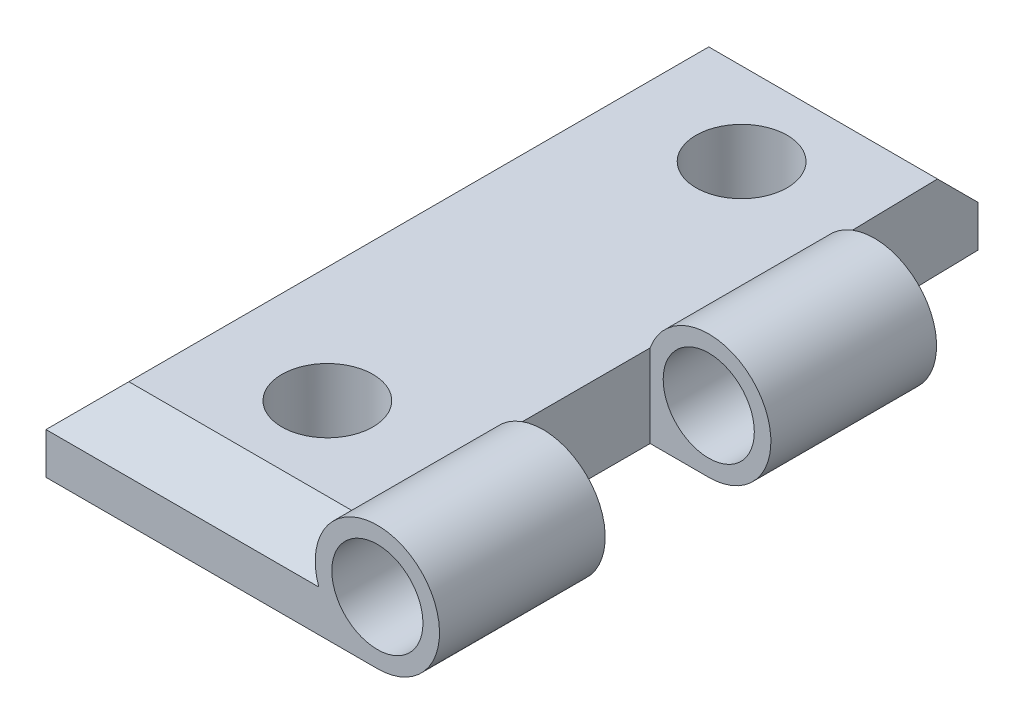
from build123d import *

# Parameters (mm, degrees)
IZIM1_R                     = 2.75
Y_KSEKLIK_EKSTR_ZYON1_DEPTH = 40
PAH3_SIZE                   = 2.5
IZIM2_R                     = 2.75
IZIM2_W                     = 7.285533906
IZIM2_H                     = 10
KES_EKSTR_ZYON1_DEPTH       = 40
KES_EKSTR_ZYON2_DEPTH       = 88


with BuildPart() as part:
    # Çizim1 → Yükseklik-Ekstrüzyon1 (new body)
    with BuildSketch(Plane.XY):
        with BuildLine():
            Line((-64.233873571, 5), (-64.233873571, 0))
            Line((-64.233873571, 0), (-44.233873571, 0))
            ThreePointArc((-44.233873571, 0), (-41.172011393, 5.915063509), (-47.769407477, 5))
            Line((-47.769407477, 5), (-64.233873571, 5))
        make_face()
        with Locations((-44.233873571, 3.75)):
            Circle(IZIM1_R, mode=Mode.SUBTRACT)
    extrude(amount=Y_KSEKLIK_EKSTR_ZYON1_DEPTH)

    # Pah3
    pah3_edges = [part.edges().sort_by_distance(p)[0] for p in [
        (-56.001640524, 5, 40),
        (-56.001640524, 5, 0),
        (-64.233873571, 5, 20),
    ]]
    chamfer(pah3_edges, length=PAH3_SIZE)

    # Çizim2 → Kes-Ekstrüzyon1 (cut)
    with BuildSketch(Plane(origin=(0, 0, 0), x_dir=(1, 0, 0), z_dir=(0, 1, 0))):
        with Locations(Location((-54.751640524, -32.5, 0), (0, 0, 90))):
            Circle(IZIM2_R)
        with Locations(Location((-54.751640524, -7.5, 0), (0, 0, 90))):
            Circle(IZIM2_R)
        with Locations((-44.126640524, -25)):
            Rectangle(IZIM2_W, IZIM2_H)
        Polygon((-40.483873571, 0), (-47.983873571, 0), (-47.769407477, -10), (-40.483873571, -10), align=None)
    extrude(amount=KES_EKSTR_ZYON1_DEPTH, mode=Mode.SUBTRACT)

    # Çizim3 → Kes-Ekstrüzyon2 (cut)
    with BuildSketch(Plane(origin=(0, 0, 0), x_dir=(0, 0, -1), z_dir=(1, 0, 0))):
        Polygon((-0.875256962, 3.375256962), (-1.784369295, 4.284369295), (0.59171966, 4.284369295), (0.36885853, 3.16350742), align=None)
    extrude(amount=-KES_EKSTR_ZYON2_DEPTH, mode=Mode.SUBTRACT)


solid = part.part
